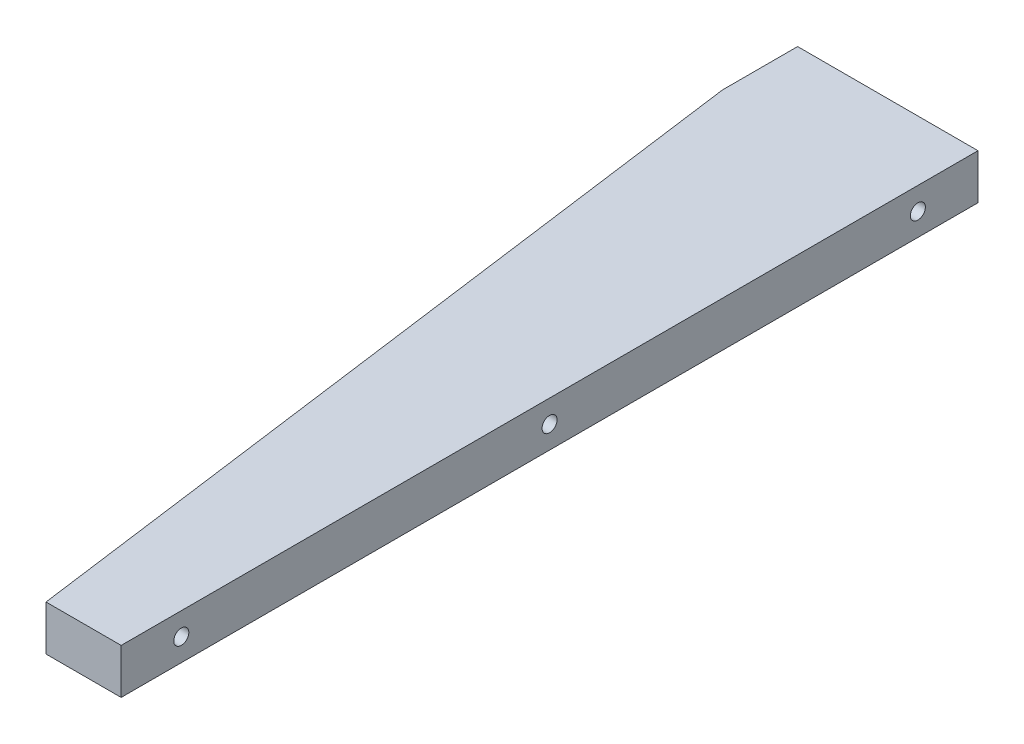
from build123d import *

# Parameters (mm, degrees)
BOSS_EXTRUDE1_DEPTH   = 15
M6_TAPPED_HOLE1_D     = 5
M6_TAPPED_HOLE1_DEPTH = 10
M6_TAPPED_HOLE1_TIP   = 1.502151548
M6_TAPPED_HOLE2_D     = 5
M6_TAPPED_HOLE2_DEPTH = 10
M6_TAPPED_HOLE2_TIP   = 1.502151548


with BuildPart() as part:
    # Sketch1 → Boss-Extrude1 (new body)
    with BuildSketch(Plane(origin=(0, 0, 0), x_dir=(1, 0, 0), z_dir=(0, 1, 0))):
        Polygon((0, 0), (0, -285), (-25, -285), (-60, -25), (-60, 0), align=None)
    extrude(amount=BOSS_EXTRUDE1_DEPTH)

    # M6 Tapped Hole1
    with Locations(Plane(origin=(0, 0, 0), x_dir=(-1, 0, 0), z_dir=(0, 0, -1))):
        with Locations((45, 7.5)):
            Hole(M6_TAPPED_HOLE1_D / 2, depth=M6_TAPPED_HOLE1_DEPTH)
            with Locations((0, 0, -(M6_TAPPED_HOLE1_DEPTH + M6_TAPPED_HOLE1_TIP / 2))):  # 118° drill point
                Cone(0, M6_TAPPED_HOLE1_D / 2, M6_TAPPED_HOLE1_TIP, mode=Mode.SUBTRACT)

    # M6 Tapped Hole2
    with Locations(Plane(origin=(0, 0, 0), x_dir=(0, 0, -1), z_dir=(1, 0, 0))):
        with Locations((-265, 7.5), (-142.5, 7.5), (-20, 7.5)):
            Hole(M6_TAPPED_HOLE2_D / 2, depth=M6_TAPPED_HOLE2_DEPTH)
            with Locations((0, 0, -(M6_TAPPED_HOLE2_DEPTH + M6_TAPPED_HOLE2_TIP / 2))):  # 118° drill point
                Cone(0, M6_TAPPED_HOLE2_D / 2, M6_TAPPED_HOLE2_TIP, mode=Mode.SUBTRACT)


solid = part.part
